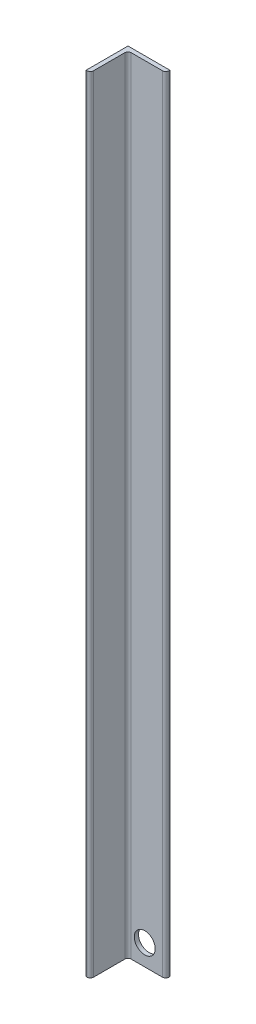
from build123d import *

# Parameters (mm, degrees)
BOSS_EXTRUDE1_DEPTH = 750
SKETCH2_R           = 10
CUT_EXTRUDE1_DEPTH  = 754.891393199


with BuildPart() as part:
    # Sketch1 → Boss-Extrude1 (new body)
    with BuildSketch(Plane(origin=(0, 0, 0), x_dir=(1, 0, 0), z_dir=(0, 1, 0))):
        with BuildLine():
            Line((-27.499872145, 29.213153277), (-67.499872145, 29.213153277))
            Line((-67.499872145, 29.213153277), (-67.499872145, -10.786846723))
            Line((-67.499872145, -10.786846723), (-66.499872145, -10.786846723))
            ThreePointArc((-66.499872145, -10.786846723), (-64.378551801, -9.908167067), (-63.499872145, -7.786846723))
            Line((-63.499872145, -7.786846723), (-63.499872145, 22.213153277))
            ThreePointArc((-63.499872145, 22.213153277), (-62.621192489, 24.334473621), (-60.499872145, 25.213153277))
            Line((-60.499872145, 25.213153277), (-30.499872145, 25.213153277))
            ThreePointArc((-30.499872145, 25.213153277), (-28.378551801, 26.091832933), (-27.499872145, 28.213153277))
            Line((-27.499872145, 28.213153277), (-27.499872145, 29.213153277))
        make_face()
    extrude(amount=BOSS_EXTRUDE1_DEPTH)

    # Sketch2 → Cut-Extrude1 (cut, through all)
    with BuildSketch(Plane.XY.offset(-25.213153277)):
        with Locations((-47.499872145, 20)):
            Circle(SKETCH2_R)
    extrude(amount=-CUT_EXTRUDE1_DEPTH, mode=Mode.SUBTRACT)


solid = part.part
